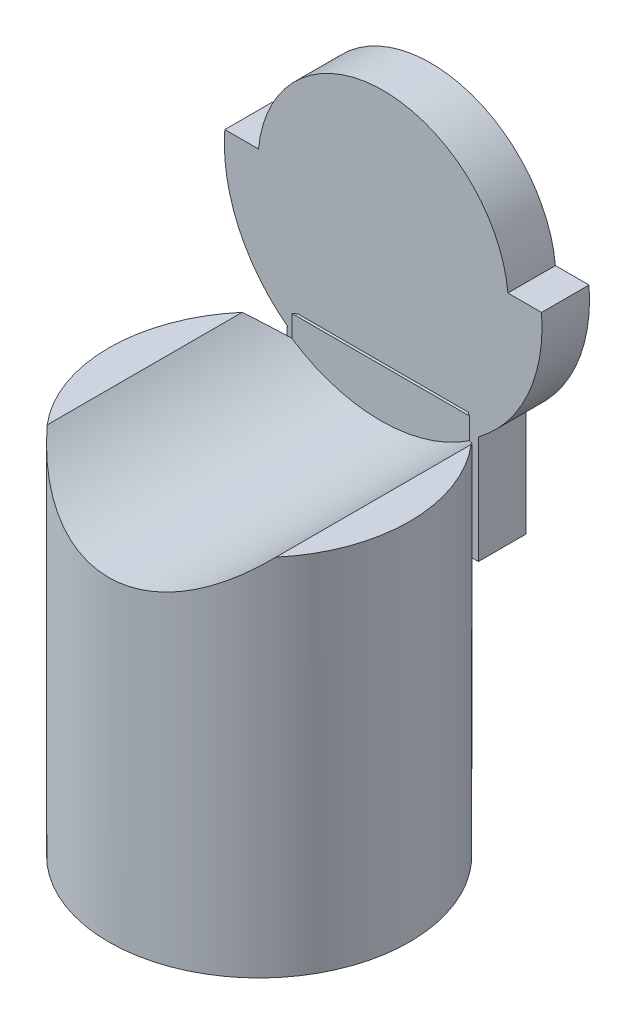
from build123d import *

# Parameters (mm, degrees)
BOSS_EXTRUDE1_START     = -0.021
SKETCH1_R               = 0.028494157
BOSS_EXTRUDE1_DEPTH     = 0.069
BOSS_EXTRUDE2_START     = -0.0235
BOSS_EXTRUDE2_DEPTH     = 0.009
CUT_EXTRUDE1_DEPTH      = 1.100309452
CUT_EXTRUDE1_DEPTH_BACK = 0.023
SKETCH3_R               = 0.030190841


with BuildPart() as part:
    # Sketch1 → Boss-Extrude1 (new body)
    with BuildSketch(Plane(origin=(0, 0, 0), x_dir=(1, 0, 0), z_dir=(0, 1, 0)).offset(BOSS_EXTRUDE1_START)):
        with Locations(Location((0, 0, 0), (0, 0, 270))):
            Circle(SKETCH1_R)
    extrude(amount=-BOSS_EXTRUDE1_DEPTH)

    # Sketch2 → Boss-Extrude2 (add)
    with BuildSketch(Plane.XY.offset(BOSS_EXTRUDE2_START)):
        with BuildLine():
            Line((-0.030006367, 0.002313885), (-0.023629396, 0.002313885))
            ThreePointArc((-0.023629396, 0.002313885), (0, 0.023742418), (0.023629396, 0.002313885))
            Line((0.023629396, 0.002313885), (0.030006367, 0.002313885))
            ThreePointArc((0.030006367, 0.002313885), (0.02741159, -0.012423398), (0.01803999, -0.02408931))
            Line((0.01803999, -0.02408931), (0.01803999, -0.044550196))
            Line((0.01803999, -0.044550196), (-0.018210349, -0.044550196))
            Line((-0.018210349, -0.044550196), (-0.01803999, -0.02408931))
            ThreePointArc((-0.01803999, -0.02408931), (-0.02741159, -0.012423398), (-0.030006367, 0.002313885))
        make_face()
    extrude(amount=-BOSS_EXTRUDE2_DEPTH)

    # Sketch3 → Cut-Extrude1 (cut, two sides: drawn at the far end of the back side and taken through both)
    with BuildSketch(Plane.XY.offset(-CUT_EXTRUDE1_DEPTH_BACK)):
        Circle(SKETCH3_R)
    extrude(amount=CUT_EXTRUDE1_DEPTH + CUT_EXTRUDE1_DEPTH_BACK, mode=Mode.SUBTRACT)


solid = part.part
